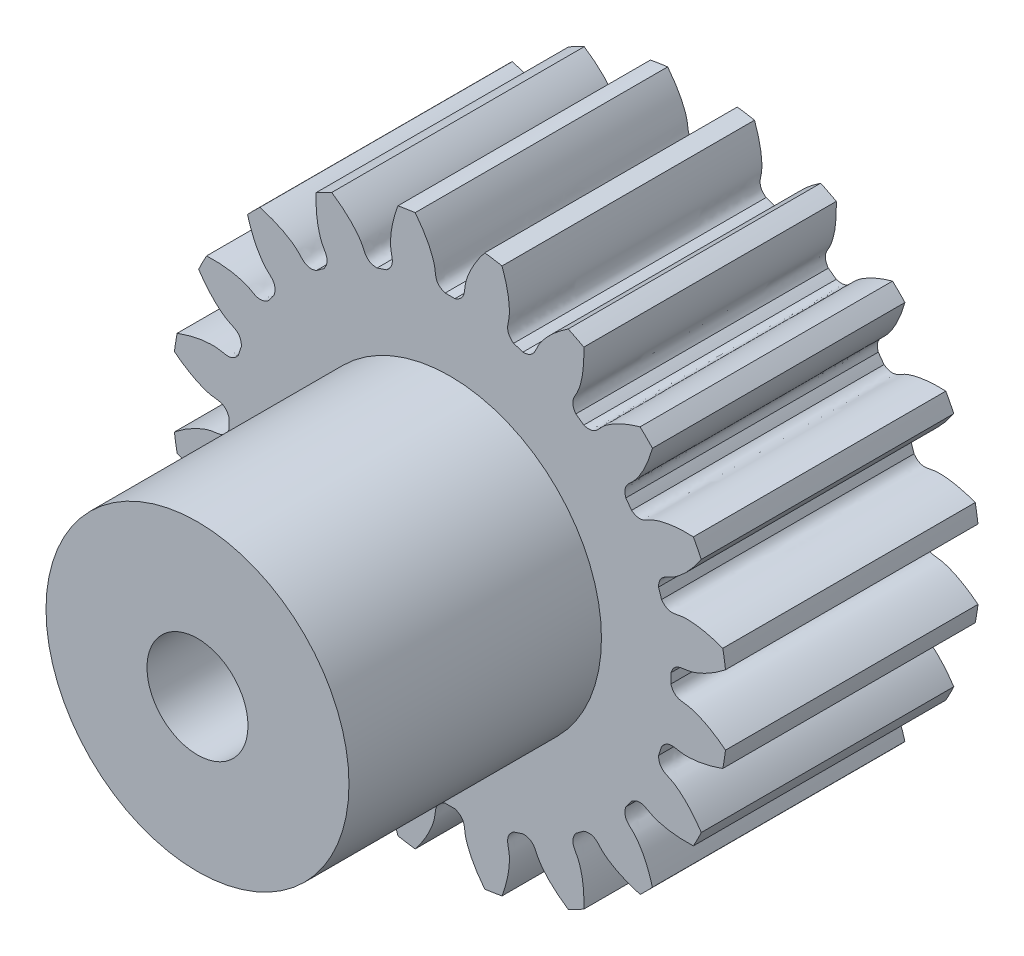
from build123d import *

# Parameters (mm, degrees)
SKETCH_1_R               = 5.5
EXTRUDE_1_DEPTH          = 5
CUT_EXTRUDE_1_DEPTH      = 10.246621004
PATTERN_CIRCULAR_1_COUNT = 20
SKETCH_5_R               = 3
SKETCH_5_R_2             = 1
EXTRUDE_2_DEPTH          = 5


with BuildPart() as part:
    # 草图1 → 凸台-拉伸1 (new body)
    with BuildSketch(Plane.XY):
        Circle(SKETCH_1_R)
    extrude(amount=EXTRUDE_1_DEPTH)

    # 草图2 → 切除-拉伸1 (cut, through all)
    with BuildSketch(Plane.XY):
        with BuildLine():
            ThreePointArc((0.0966583, 4.373932118), (0, 4.375), (-0.0966583, 4.373932118))
            add(Edge.make_bspline(
                [(-0.0966583, 4.373932118), (-0.305594702, 4.446737756), (-0.27854205, 4.593556849), (-0.306448528, 4.735004701), (-0.309446093, 4.748778307), (-0.313155445, 4.764317308), (-0.317646048, 4.781598418), (-0.32298957, 4.800595748), (-0.329256028, 4.821281414), (-0.336514936, 4.843625367), (-0.344834875, 4.867595474), (-0.35428355, 4.893157523), (-0.364927699, 4.92027525), (-0.376833051, 4.948910365), (-0.390064266, 4.979022576), (-0.404684882, 5.010569616), (-0.420757267, 5.043507275), (-0.438342558, 5.077789431), (-0.457500619, 5.113368075), (-0.478289983, 5.150193352), (-0.500767805, 5.18821359), (-0.524989813, 5.227375339), (-0.551010261, 5.267623403), (-0.578881878, 5.308900882), (-0.608655826, 5.35114921), (-0.64038165, 5.394308195), (-0.67410724, 5.43831606), (-0.709878781, 5.483109486), (-0.747740713, 5.528623656), (-0.787735693, 5.574792297), (-0.829904548, 5.621547731), (-0.874286244, 5.668820917), (-0.920917842, 5.716541501), (-0.969834463, 5.764637863), (-1.021069253, 5.81303717), (-1.074653349, 5.861665421), (-1.130615845, 5.910447505), (-1.188983759, 5.95930725), (-1.249782006, 6.008167473), (-1.313033367, 6.056950041), (-1.37875845, 6.10557592), (-1.470736795, 6.170819934), (-1.541966206, 6.218166301), (-1.590578991, 6.24912593)],
                knots=[0, 0, 0, 0, 0.165916003, 0.170905922, 0.176663519, 0.183188797, 0.190481754, 0.198542391, 0.207370708, 0.216966704, 0.22733038, 0.238461736, 0.250360771, 0.263027487, 0.276461881, 0.290663956, 0.30563371, 0.321371144, 0.337876258, 0.355149051, 0.373189524, 0.391997677, 0.411573509, 0.431917021, 0.453028213, 0.474907084, 0.497553636, 0.520967867, 0.545149777, 0.570099367, 0.595816637, 0.622301587, 0.649554216, 0.677574526, 0.706362514, 0.735918183, 0.766241531, 0.797332559, 0.829191267, 0.861817654, 0.895211721, 0.929373468, 1, 1, 1, 1], degree=3))
            ThreePointArc((-1.590578991, 6.24912593), (0, 6.44837316), (1.590578991, 6.24912593))
            add(Edge.make_bspline(
                [(0.0966583, 4.373932118), (0.305594702, 4.446737756), (0.27854205, 4.593556849), (0.306448528, 4.735004701), (0.309446093, 4.748778307), (0.313155445, 4.764317308), (0.317646048, 4.781598418), (0.32298957, 4.800595748), (0.329256028, 4.821281414), (0.336514936, 4.843625367), (0.344834875, 4.867595474), (0.35428355, 4.893157523), (0.364927699, 4.92027525), (0.376833051, 4.948910365), (0.390064266, 4.979022576), (0.404684882, 5.010569616), (0.420757267, 5.043507275), (0.438342558, 5.077789431), (0.457500619, 5.113368075), (0.478289983, 5.150193352), (0.500767805, 5.18821359), (0.524989813, 5.227375339), (0.551010261, 5.267623403), (0.578881878, 5.308900882), (0.608655826, 5.35114921), (0.64038165, 5.394308195), (0.67410724, 5.43831606), (0.709878781, 5.483109486), (0.747740713, 5.528623656), (0.787735693, 5.574792297), (0.829904548, 5.621547731), (0.874286244, 5.668820917), (0.920917842, 5.716541501), (0.969834463, 5.764637863), (1.021069253, 5.81303717), (1.074653349, 5.861665421), (1.130615845, 5.910447505), (1.188983759, 5.95930725), (1.249782006, 6.008167473), (1.313033367, 6.056950041), (1.37875845, 6.10557592), (1.470736795, 6.170819934), (1.541966206, 6.218166301), (1.590578991, 6.24912593)],
                knots=[0, 0, 0, 0, 0.165916003, 0.170905922, 0.176663519, 0.183188797, 0.190481754, 0.198542391, 0.207370708, 0.216966704, 0.22733038, 0.238461736, 0.250360771, 0.263027487, 0.276461881, 0.290663956, 0.30563371, 0.321371144, 0.337876258, 0.355149051, 0.373189524, 0.391997677, 0.411573509, 0.431917021, 0.453028213, 0.474907084, 0.497553636, 0.520967867, 0.545149777, 0.570099367, 0.595816637, 0.622301587, 0.649554216, 0.677574526, 0.706362514, 0.735918183, 0.766241531, 0.797332559, 0.829191267, 0.861817654, 0.895211721, 0.929373468, 1, 1, 1, 1], degree=3))
        make_face()
    cut_extrude_1 = extrude(amount=CUT_EXTRUDE_1_DEPTH, mode=Mode.SUBTRACT)

    # 阵列(圆周)1: 切除-拉伸1 ×20 about axis
    pattern_circular_1_axis = Axis((0, 0, 5), (0, 0, -1))
    for i in range(1, PATTERN_CIRCULAR_1_COUNT):
        add(cut_extrude_1.rotate(pattern_circular_1_axis, i * 360 / PATTERN_CIRCULAR_1_COUNT), mode=Mode.SUBTRACT)

    # 草图5 → 凸台-拉伸2 (add)
    with BuildSketch(Plane.XY.offset(5)):
        Circle(SKETCH_5_R)
        Circle(SKETCH_5_R_2, mode=Mode.SUBTRACT)
    extrude(amount=EXTRUDE_2_DEPTH)


solid = part.part
